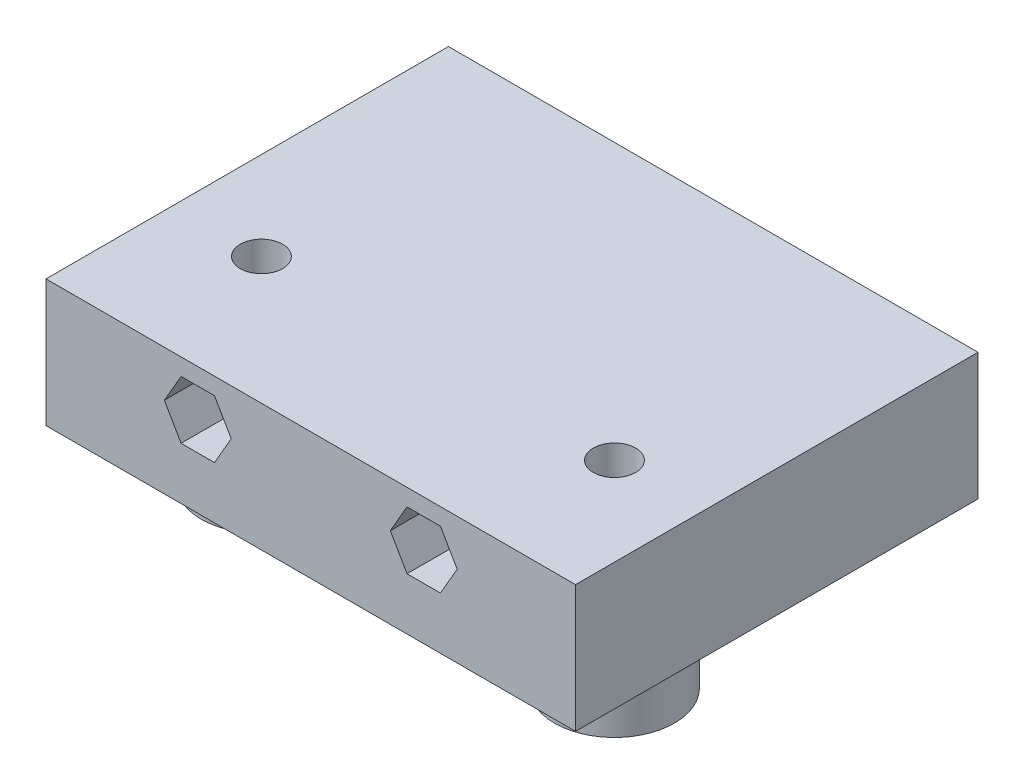
from build123d import *

# Parameters (mm, degrees)
SKETCH1_W           = 75
SKETCH1_H           = 18
BOSS_EXTRUDE1_DEPTH = 57
SKETCH1_3_R         = 3
BOSS_EXTRUDE2_DEPTH = 20
BOSS_EXTRUDE3_START = -18
SKETCH2_R           = 8.5
SKETCH2_R_2         = 3
BOSS_EXTRUDE3_DEPTH = 10
SKETCH2_2_R         = 3
CUT_EXTRUDE3_DEPTH  = 18
SKETCH3_W           = 10
SKETCH3_H           = 5
CUT_EXTRUDE4_DEPTH  = 10


with BuildPart() as part:
    # Sketch1 → Boss-Extrude1 (new body)
    with BuildSketch(Plane.XY):
        with Locations((37.5, -9)):
            Rectangle(SKETCH1_W, SKETCH1_H)
        Polygon((19.132863896, -10.6), (23.867136104, -10.6), (26.234272207, -6.5), (23.867136104, -2.4), (19.132863896, -2.4), (16.765727793, -6.5), align=None, mode=Mode.SUBTRACT)
        Polygon((58.234272207, -6.5), (55.867136104, -10.6), (51.132863896, -10.6), (48.765727793, -6.5), (51.132863896, -2.4), (55.867136104, -2.4), align=None, mode=Mode.SUBTRACT)
    extrude(amount=BOSS_EXTRUDE1_DEPTH)

    # Sketch1<3> → Boss-Extrude2 (add)
    # profile 1 of 2: a face of its own
    with BuildSketch(Plane.XY):
        Polygon((16.765727793, -6.5), (19.132863896, -10.6), (23.867136104, -10.6), (26.234272207, -6.5), (23.867136104, -2.4), (19.132863896, -2.4), align=None)
        with Locations((21.5, -6.5)):
            Circle(SKETCH1_3_R, mode=Mode.SUBTRACT)
    # profile 2 of 2: a face of its own
    with BuildSketch(Plane.XY):
        Polygon((55.867136104, -10.6), (58.234272207, -6.5), (55.867136104, -2.4), (51.132863896, -2.4), (48.765727793, -6.5), (51.132863896, -10.6), align=None)
        with Locations((53.5, -6.5)):
            Circle(SKETCH1_3_R, mode=Mode.SUBTRACT)
    extrude(amount=BOSS_EXTRUDE2_DEPTH)

    # Sketch2 → Boss-Extrude3 (add)
    # profile 1 of 2: a face of its own
    with BuildSketch(Plane(origin=(0, 0, 0), x_dir=(1, 0, 0), z_dir=(0, 1, 0)).offset(BOSS_EXTRUDE3_START)):
        with Locations(Location((12.5, -38.99, 0), (0, 0, 270))):
            Circle(SKETCH2_R)
        with Locations(Location((12.5, -38.99, 0), (0, 0, 270))):
            Circle(SKETCH2_R_2, mode=Mode.SUBTRACT)
    # profile 2 of 2: a face of its own
    with BuildSketch(Plane(origin=(0, 0, 0), x_dir=(1, 0, 0), z_dir=(0, 1, 0)).offset(BOSS_EXTRUDE3_START)):
        with Locations(Location((62.5, -38.99, 0), (0, 0, 270))):
            Circle(SKETCH2_R)
        with Locations(Location((62.5, -38.99, 0), (0, 0, 270))):
            Circle(SKETCH2_R_2, mode=Mode.SUBTRACT)
    extrude(amount=-BOSS_EXTRUDE3_DEPTH)

    # Sketch2<2> → Cut-Extrude3 (cut)
    with BuildSketch(Plane(origin=(0, 0, 0), x_dir=(1, 0, 0), z_dir=(0, 1, 0))):
        with Locations(Location((12.5, -38.99, 0), (0, 0, 270))):
            Circle(SKETCH2_2_R)
        with Locations(Location((62.5, -38.99, 0), (0, 0, 270))):
            Circle(SKETCH2_2_R)
    extrude(amount=-CUT_EXTRUDE3_DEPTH, mode=Mode.SUBTRACT)

    # Sketch3 → Cut-Extrude4 (cut)
    with BuildSketch(Plane.XZ.offset(18)):
        with Locations((21.5, 22)):
            Rectangle(SKETCH3_W, SKETCH3_H)
        with Locations((53.5, 22)):
            Rectangle(SKETCH3_W, SKETCH3_H)
    extrude(amount=-CUT_EXTRUDE4_DEPTH, mode=Mode.SUBTRACT)


solid = part.part
